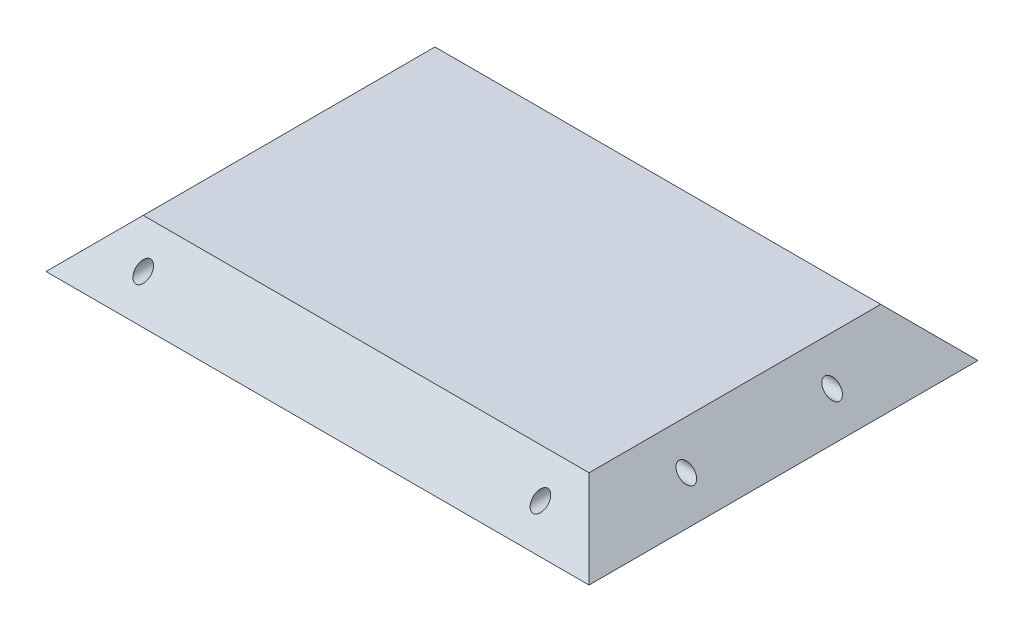
from build123d import *

# Parameters (mm, degrees)
SKETCH_3_R          = 1.5
CUT_EXTRUDE_1_DEPTH = 20
SKETCH_4_R          = 1.5
CUT_EXTRUDE_2_DEPTH = 20
CUT_EXTRUDE_3_DEPTH = 0.6


with BuildPart() as part:
    # Эскиз1 → По сечениям1 section 0
    with BuildSketch(Plane(origin=(0, 0, 0), x_dir=(1, 0, 0), z_dir=(0, 1, 0))):
        with BuildLine():
            Line((-55.85, -40), (55.85, -40))
            Line((55.85, -40), (55.85, 40))
            Line((55.85, 40), (-55.85, 40))
            Line((-55.85, 40), (-55.85, -40))
        make_face()
    # Эскиз2 → По сечениям1 section 1
    with BuildSketch(Plane(origin=(0, 10, 0), x_dir=(1, 0, 0), z_dir=(0, 1, 0))):
        with BuildLine():
            Line((45.85, 30), (-45.85, 30))
            Line((-45.85, 30), (-45.85, -30))
            Line((-45.85, -30), (45.85, -30))
            Line((45.85, -30), (45.85, 30))
        make_face()
    loft()

    # Эскиз3 → Вырез-Вытянуть1 (cut)
    with BuildSketch(Plane.XY.offset(40)):
        with Locations((40.85, 5)):
            Circle(SKETCH_3_R)
        with Locations(Location((-40.85, 5, 0), (0, 0, 270))):
            Circle(SKETCH_3_R)
    cut_extrude_1 = extrude(amount=-CUT_EXTRUDE_1_DEPTH, mode=Mode.SUBTRACT)

    # Зеркальное отражение1: Вырез-Вытянуть1 across plane
    add(cut_extrude_1.mirror(Plane.XY), mode=Mode.SUBTRACT)

    # Эскиз4 → Вырез-Вытянуть2 (cut)
    with BuildSketch(Plane(origin=(55.85, 0, 0), x_dir=(0, 0, -1), z_dir=(1, 0, 0))):
        with Locations((-15, 5)):
            Circle(SKETCH_4_R)
        with Locations(Location((15, 5, 0), (0, 0, 270))):
            Circle(SKETCH_4_R)
    cut_extrude_2 = extrude(amount=-CUT_EXTRUDE_2_DEPTH, mode=Mode.SUBTRACT)

    # Зеркальное отражение2: Вырез-Вытянуть2 across plane
    add(cut_extrude_2.mirror(Plane(origin=(0, 0, 0), x_dir=(0, 0, 1), z_dir=(1, 0, 0))), mode=Mode.SUBTRACT)

    # Эскиз5 → Вырез-Вытянуть3 (cut)
    with BuildSketch(Plane.XZ):
        Polygon((-10.85, 25), (-40.85, 25), (-40.85, -5), (-41.35, -5), (-40.35, -6), (-39.35, -5), (-39.85, -5), (-39.85, 24), (-10.85, 24), (-10.85, 23.5), (-9.85, 24.5), (-10.85, 25.5), align=None)
    extrude(amount=-CUT_EXTRUDE_3_DEPTH, mode=Mode.SUBTRACT)


solid = part.part
